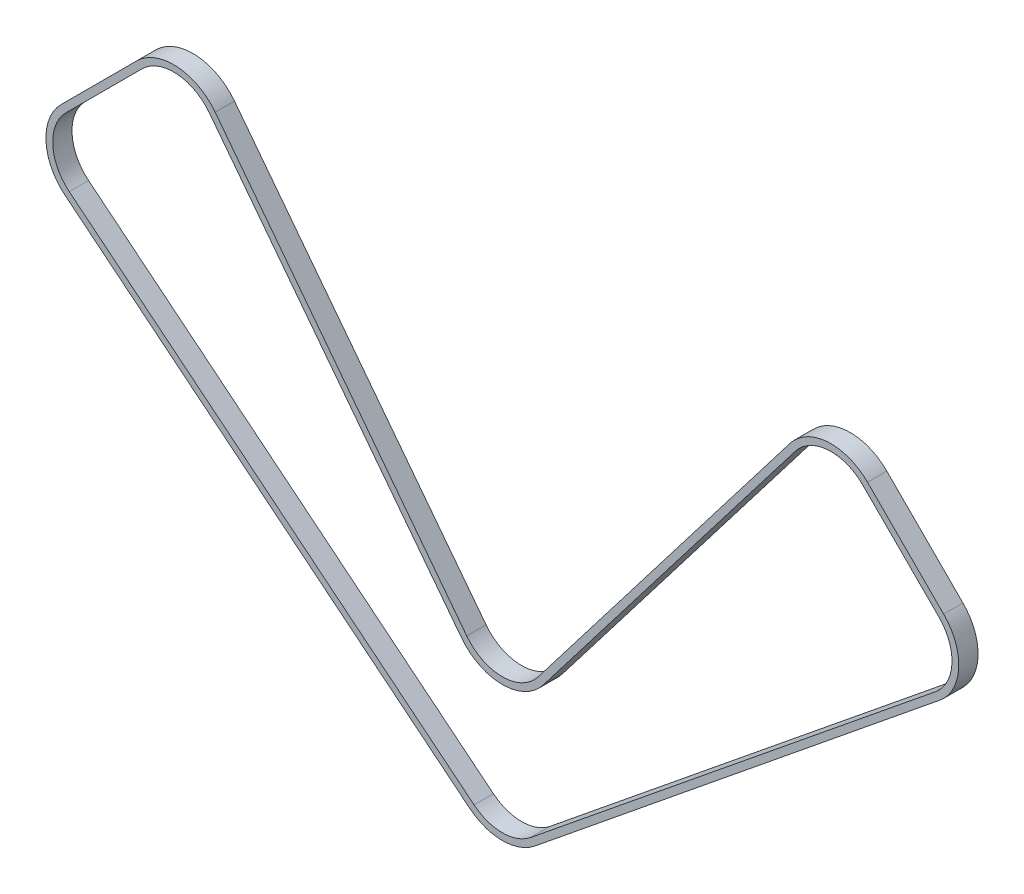
from build123d import *

# Parameters (mm, degrees)
BOSS_EXTRUDE1_DEPTH      = 5
BOSS_EXTRUDE1_DEPTH_BACK = 5


with BuildPart() as part:
    # Sketch3 → Boss-Extrude1 (new, two sides: drawn at the far end of the back side and taken through both)
    with BuildSketch(Plane.XY.offset(-BOSS_EXTRUDE1_DEPTH_BACK)):
        with BuildLine():
            Line((-148.773080728, 225.6468162), (-18.440943254, 55.845528153))
            ThreePointArc((-18.440943254, 55.845528153), (0, 46.75311932), (18.440943254, 55.845528153))
            Line((18.440943254, 55.845528153), (148.773080728, 225.6468162))
            ThreePointArc((148.773080728, 225.6468162), (168.290702347, 236.386792537), (189.171977646, 228.624255112))
            Line((189.171977646, 228.624255112), (228.624255112, 189.171977646))
            ThreePointArc((228.624255112, 189.171977646), (236.423365061, 168.873706393), (226.569637526, 149.489434791))
            Line((226.569637526, 149.489434791), (16.86048881, -20.767436459))
            ThreePointArc((16.86048881, -20.767436459), (0, -26.75), (-16.86048881, -20.767436459))
            Line((-16.86048881, -20.767436459), (-226.569637526, 149.489434791))
            ThreePointArc((-226.569637526, 149.489434791), (-236.423365061, 168.873706393), (-228.624255112, 189.171977646))
            Line((-228.624255112, 189.171977646), (-189.171977646, 228.624255112))
            ThreePointArc((-189.171977646, 228.624255112), (-168.30539851, 236.187390033), (-148.773080728, 225.6468162))
        make_face()
        with BuildLine():
            Line((-21.483790521, 54.062332516), (-151.815927996, 223.863620563))
            ThreePointArc((-151.815927996, 223.863620563), (-168.738130189, 232.90636594), (-186.69489822, 226.147175686))
            Line((-186.69489822, 226.147175686), (-226.147175686, 186.69489822))
            ThreePointArc((-226.147175686, 186.69489822), (-232.924931888, 169.054842525), (-224.361626158, 152.20909116))
            Line((-224.361626158, 152.20909116), (-14.652477443, -18.04778009))
            ThreePointArc((-14.652477443, -18.04778009), (0, -23.24688068), (14.652477443, -18.04778009))
            Line((14.652477443, -18.04778009), (224.361626158, 152.20909116))
            ThreePointArc((224.361626158, 152.20909116), (232.924931888, 169.054842525), (226.147175686, 186.69489822))
            Line((226.147175686, 186.69489822), (186.69489822, 226.147175686))
            ThreePointArc((186.69489822, 226.147175686), (168.738130189, 232.90636594), (151.815927996, 223.863620563))
            Line((151.815927996, 223.863620563), (21.483790521, 54.062332516))
            ThreePointArc((21.483790521, 54.062332516), (0, 43.25), (-21.483790521, 54.062332516))
        make_face(mode=Mode.SUBTRACT)
    extrude(amount=BOSS_EXTRUDE1_DEPTH + BOSS_EXTRUDE1_DEPTH_BACK)


solid = part.part
